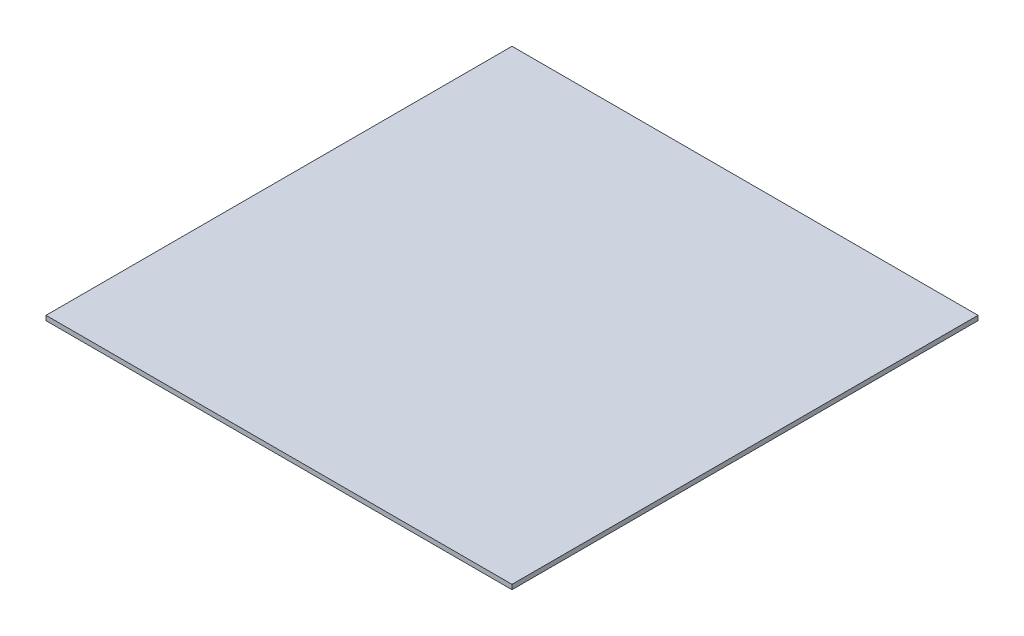
from build123d import *

# Parameters (mm, degrees)
SKETCH1_W           = 200
SKETCH1_H           = 200
BOSS_EXTRUDE1_DEPTH = 2


with BuildPart() as part:
    # Sketch1 → Boss-Extrude1 (new body)
    with BuildSketch(Plane(origin=(0, 0, 0), x_dir=(1, 0, 0), z_dir=(0, 1, 0))):
        Rectangle(SKETCH1_W, SKETCH1_H)
    extrude(amount=BOSS_EXTRUDE1_DEPTH)


solid = part.part
